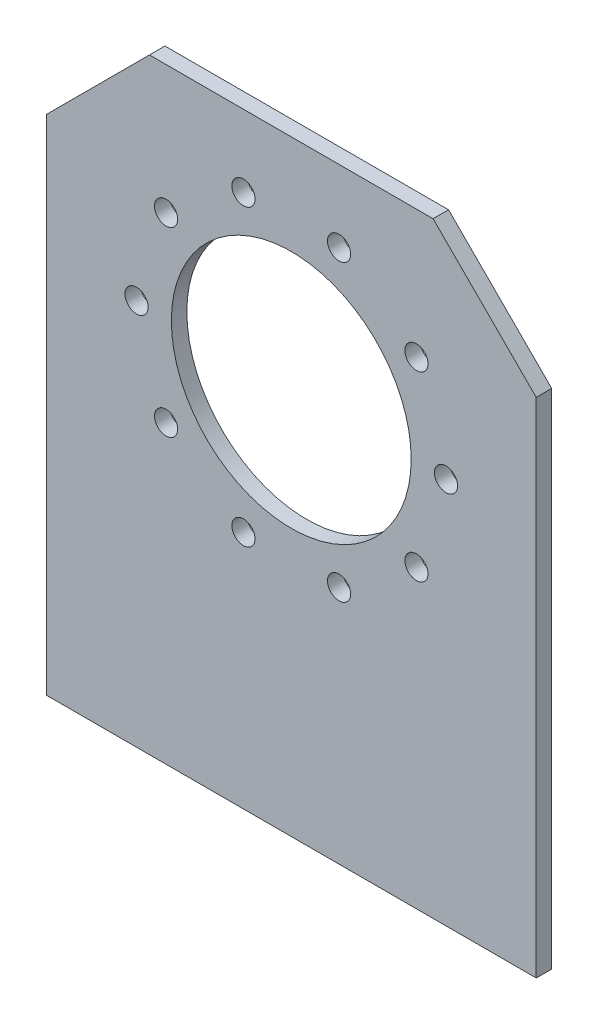
from build123d import *

# Parameters (mm, degrees)
SKETCH1_R           = 46.5
SKETCH1_R_2         = 4.5
BOSS_EXTRUDE1_DEPTH = 6


with BuildPart() as part:
    # Sketch1 → Boss-Extrude1 (new body)
    with BuildSketch(Plane.XY):
        Polygon((-95, 77.5), (-55, 117.5), (55, 117.5), (95, 77.5), (95, -117.5), (-95, -117.5), align=None)
        with Locations((0, 32.5)):
            Circle(SKETCH1_R, mode=Mode.SUBTRACT)
        with Locations((-60, 32.5)):
            Circle(SKETCH1_R_2, mode=Mode.SUBTRACT)
        with Locations((-48.541019662, 67.767115138)):
            Circle(SKETCH1_R_2, mode=Mode.SUBTRACT)
        with Locations((-18.541019662, 89.563390978)):
            Circle(SKETCH1_R_2, mode=Mode.SUBTRACT)
        with Locations((18.541019662, 89.563390978)):
            Circle(SKETCH1_R_2, mode=Mode.SUBTRACT)
        with Locations((48.541019662, 67.767115138)):
            Circle(SKETCH1_R_2, mode=Mode.SUBTRACT)
        with Locations((60, 32.5)):
            Circle(SKETCH1_R_2, mode=Mode.SUBTRACT)
        with Locations((48.541019662, -2.767115138)):
            Circle(SKETCH1_R_2, mode=Mode.SUBTRACT)
        with Locations((18.541019662, -24.563390978)):
            Circle(SKETCH1_R_2, mode=Mode.SUBTRACT)
        with Locations((-18.541019662, -24.563390978)):
            Circle(SKETCH1_R_2, mode=Mode.SUBTRACT)
        with Locations((-48.541019662, -2.767115138)):
            Circle(SKETCH1_R_2, mode=Mode.SUBTRACT)
    extrude(amount=BOSS_EXTRUDE1_DEPTH)


solid = part.part
